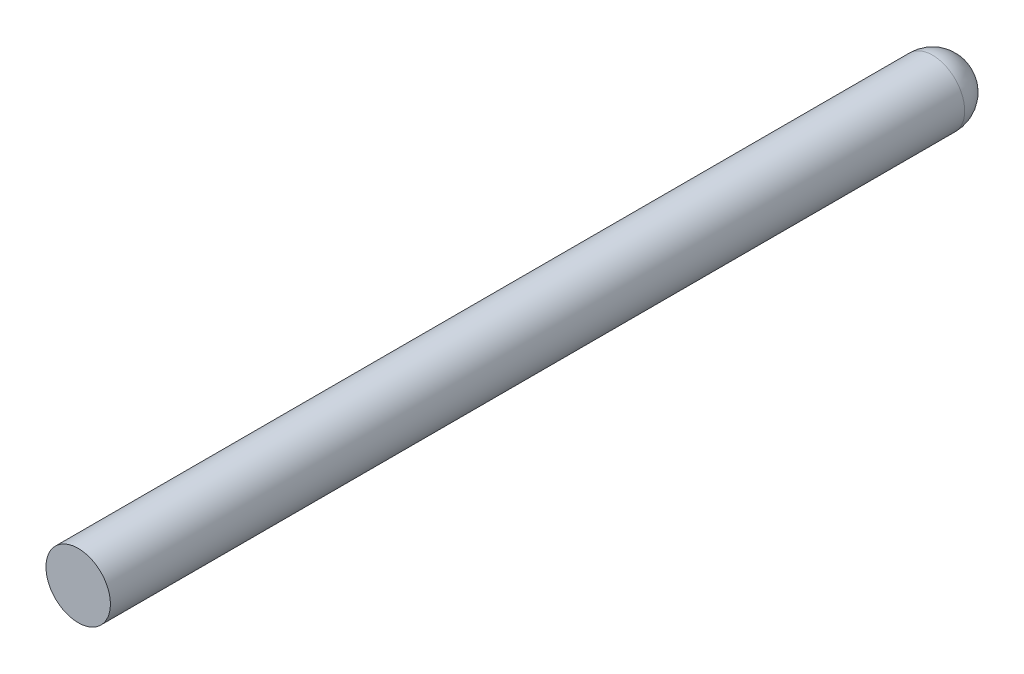
from build123d import *


with BuildPart() as part:
    # Sketch1 → Revolve1 (revolve)
    with BuildSketch(Plane(origin=(0, 0, 0), x_dir=(1, 0, 0), z_dir=(0, 1, 0))):
        with BuildLine():
            Line((0, 0), (0, 110))
            ThreePointArc((0, 110), (2.828427125, 108.828427125), (4, 106))
            Line((4, 106), (4, 0))
            Line((4, 0), (0, 0))
        make_face()
    revolve(axis=Axis((0, 0, 1425.594246993), (0, 0, -1)))


solid = part.part
